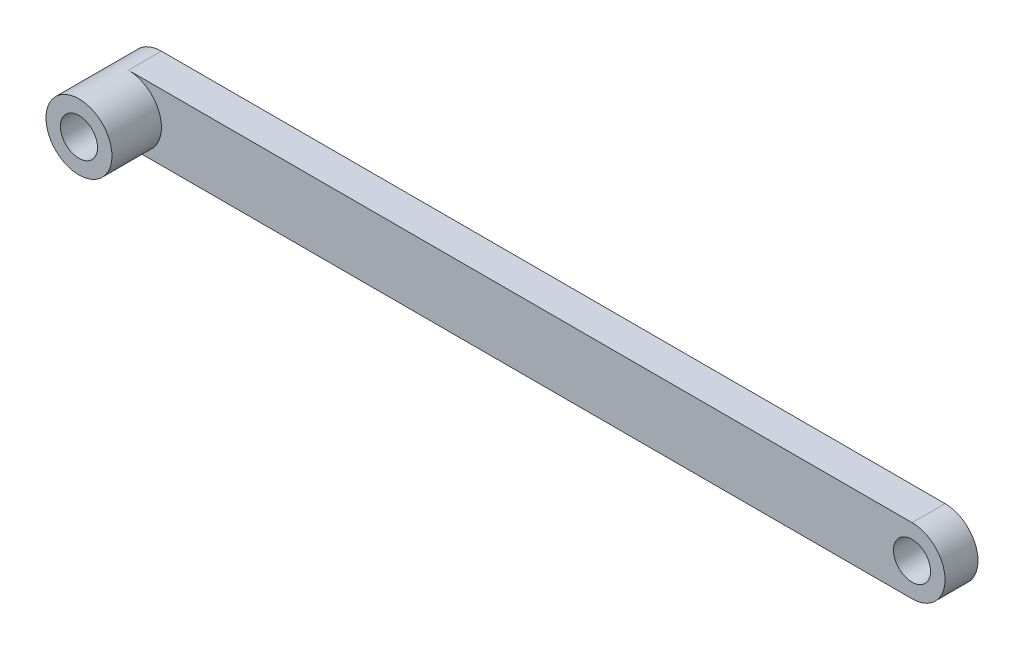
from build123d import *

# Parameters (mm, degrees)
SKETCH2_R               = 2.25
BOSS_EXTRUDE1_DEPTH     = 10
CUT_EXTRUDE_THIN1_START = -6
SKETCH3_R               = 104
SKETCH3_R_2             = 4
CUT_EXTRUDE_THIN1_DEPTH = 6


with BuildPart() as part:
    # Sketch2 → Boss-Extrude1 (new body)
    with BuildSketch(Plane.XY):
        with BuildLine():
            Line((0, 4), (95, 4))
            ThreePointArc((95, 4), (99, 0), (95, -4))
            Line((95, -4), (0, -4))
            ThreePointArc((0, -4), (-4, 0), (0, 4))
        make_face()
        Circle(SKETCH2_R, mode=Mode.SUBTRACT)
        with Locations((95, 0)):
            Circle(SKETCH2_R, mode=Mode.SUBTRACT)
    extrude(amount=BOSS_EXTRUDE1_DEPTH)

    # Sketch3 → Cut-Extrude-Thin1 (cut)
    with BuildSketch(Plane.XY.offset(10).offset(CUT_EXTRUDE_THIN1_START)):
        Circle(SKETCH3_R)
        Circle(SKETCH3_R_2, mode=Mode.SUBTRACT)
    extrude(amount=CUT_EXTRUDE_THIN1_DEPTH, mode=Mode.SUBTRACT)


solid = part.part
